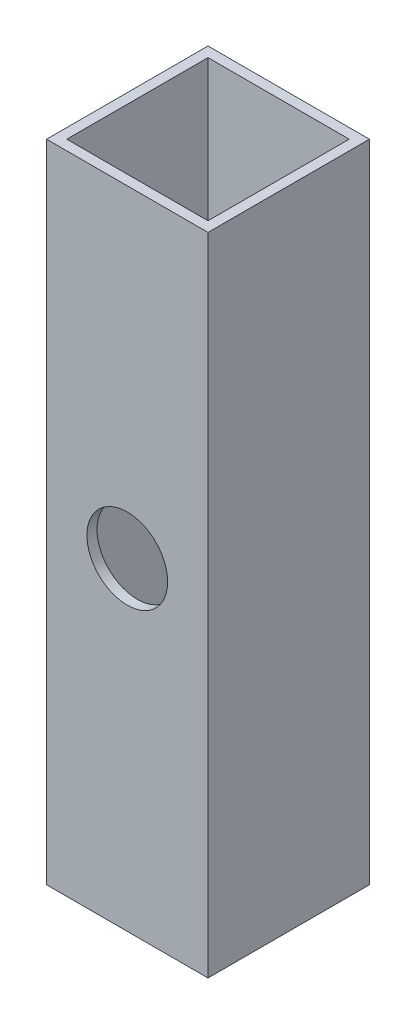
from build123d import *

# Parameters (mm, degrees)
SKETCH1_W           = 25.4
SKETCH1_H           = 25.4
SKETCH1_W_2         = 22.225
SKETCH1_H_2         = 22.225
BOSS_EXTRUDE1_DEPTH = 101.6
SKETCH2_R           = 6.35
CUT_EXTRUDE1_DEPTH  = 101.6


with BuildPart() as part:
    # Sketch1 → Boss-Extrude1 (new body)
    with BuildSketch(Plane(origin=(0, 0, 0), x_dir=(1, 0, 0), z_dir=(0, 1, 0))):
        Rectangle(SKETCH1_W, SKETCH1_H)
        Rectangle(SKETCH1_W_2, SKETCH1_H_2, mode=Mode.SUBTRACT)
    extrude(amount=BOSS_EXTRUDE1_DEPTH)

    # Sketch2 → Cut-Extrude1 (cut)
    with BuildSketch(Plane.XY.offset(12.7)):
        with Locations((0, 50.8)):
            Circle(SKETCH2_R)
    extrude(amount=-CUT_EXTRUDE1_DEPTH, mode=Mode.SUBTRACT)


solid = part.part
